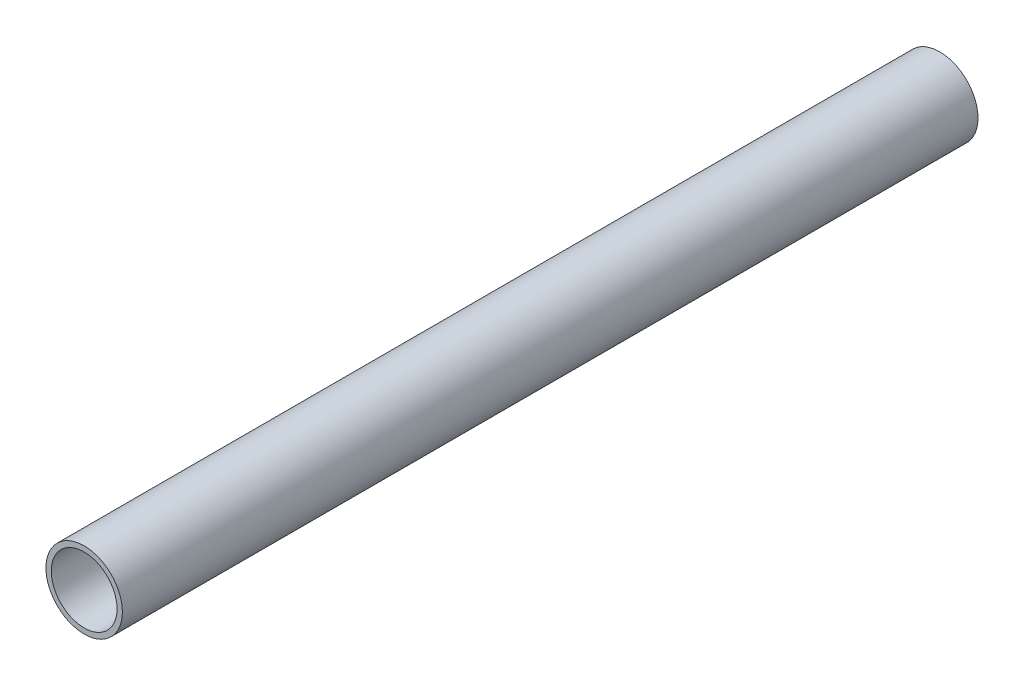
from build123d import *

# Parameters (mm, degrees)
SKETCH_1_R      = 7.55
SKETCH_1_R_2    = 6.5
EXTRUDE_1_DEPTH = 169


with BuildPart() as part:
    # 草图1 → 凸台-拉伸1 (new body)
    with BuildSketch(Plane.XY):
        Circle(SKETCH_1_R)
        Circle(SKETCH_1_R_2, mode=Mode.SUBTRACT)
    extrude(amount=EXTRUDE_1_DEPTH)


solid = part.part
